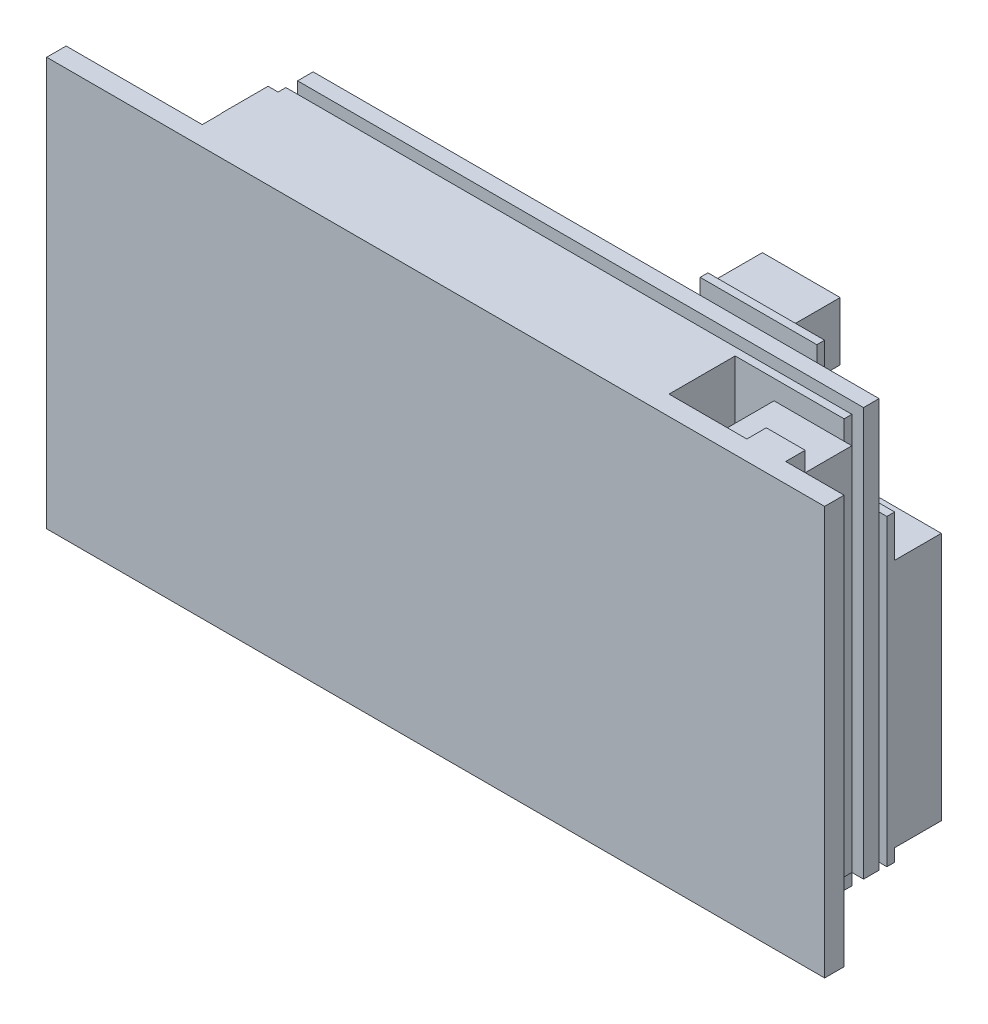
from build123d import *

# Parameters (mm, degrees)
SKETCH2_W            = 200
SKETCH2_H            = 105
BOSS_EXTRUDE1_DEPTH  = 5
SKETCH3_W            = 10
SKETCH3_H            = 105
BOSS_EXTRUDE2_DEPTH  = 5
SKETCH4_W            = 120
SKETCH4_H            = 10
BOSS_EXTRUDE3_DEPTH  = 5
SKETCH5_W            = 35
SKETCH5_H            = 50
BOSS_EXTRUDE4_DEPTH  = 5
SKETCH7_W            = 20
SKETCH7_H            = 95
SKETCH7_W_2          = 115.497788715
SKETCH7_H_2          = 20
SKETCH7_W_3          = 120.080954526
SKETCH7_W_4          = 14.207814016
SKETCH7_H_3          = 7
SKETCH7_H_4          = 10
BOSS_EXTRUDE5_DEPTH  = 12
SKETCH8_W            = 145.5
SKETCH8_H            = 105
BOSS_EXTRUDE6_DEPTH  = 2
BOSS_EXTRUDE7_DEPTH  = 4
SKETCH10_W           = 51
SKETCH10_H           = 49
BOSS_EXTRUDE8_DEPTH  = 14
SKETCH11_W           = 55
SKETCH11_H           = 78
BOSS_EXTRUDE9_DEPTH  = 2
SKETCH12_W           = 20
SKETCH12_H           = 64
SKETCH12_W_2         = 15
SKETCH12_H_2         = 20
BOSS_EXTRUDE10_DEPTH = 12
SKETCH13_W           = 30
SKETCH13_H           = 20
BOSS_EXTRUDE11_DEPTH = 2
SKETCH14_W           = 20
SKETCH14_H           = 15
BOSS_EXTRUDE12_DEPTH = 12


with BuildPart() as part:
    # Sketch2 → Boss-Extrude1 (new body)
    with BuildSketch(Plane.XY):
        with Locations((100, 52.5)):
            Rectangle(SKETCH2_W, SKETCH2_H)
    extrude(amount=BOSS_EXTRUDE1_DEPTH)

    # Sketch3 → Boss-Extrude2 (add)
    with BuildSketch(Plane(origin=(0, 0, 0), x_dir=(-1, 0, 0), z_dir=(0, 0, -1))):
        with Locations((-180, 52.5)):
            Rectangle(SKETCH3_W, SKETCH3_H)
    extrude(amount=BOSS_EXTRUDE2_DEPTH)

    # Sketch4 → Boss-Extrude3 (add)
    with BuildSketch(Plane.XY):
        with Locations((95, 5)):
            Rectangle(SKETCH4_W, SKETCH4_H)
        with Locations((95, 100)):
            Rectangle(SKETCH4_W, SKETCH4_H)
    extrude(amount=-BOSS_EXTRUDE3_DEPTH)

    # Sketch5 → Boss-Extrude4 (add)
    with BuildSketch(Plane.XY):
        with Locations((20.5, 55)):
            Rectangle(SKETCH5_W, SKETCH5_H)
    extrude(amount=-BOSS_EXTRUDE4_DEPTH)

    # Sketch7 → Boss-Extrude5 (add)
    with BuildSketch(Plane.XY.offset(-5)):
        with Locations((175, 52.5)):
            Rectangle(SKETCH7_W, SKETCH7_H)
        with Locations((97.251105642, 10)):
            Rectangle(SKETCH7_W_2, SKETCH7_H_2)
        with Locations((94.959522737, 95)):
            Rectangle(SKETCH7_W_3, SKETCH7_H_2)
        with Locations((39.043894704, 70.093234871)):
            Rectangle(SKETCH7_W_4, SKETCH7_H_3)
        with Locations((39.043894704, 46.844139488)):
            Rectangle(SKETCH7_W_4, SKETCH7_H_4)
    extrude(amount=-BOSS_EXTRUDE5_DEPTH)

    # Sketch8 → Boss-Extrude6 (add)
    with BuildSketch(Plane.XY.offset(-17)):
        with Locations((110.25, 52.5)):
            Rectangle(SKETCH8_W, SKETCH8_H)
    extrude(amount=-BOSS_EXTRUDE6_DEPTH)



with BuildPart() as body_2:
    # Sketch9 → Boss-Extrude7 (new body)
    with BuildSketch(Plane.XY.offset(-22)):
        Polygon((37.5, 0), (183, 0), (183, 105), (37.5, 105), (37.5, 77), (107.5, 77), (107.5, 28), (37.5, 28), align=None)
    extrude(amount=-BOSS_EXTRUDE7_DEPTH)


with BuildPart() as part_1:
    add(part.part)

    add(body_2.part)  # Boss-Extrude8 merges body 2
    # Sketch10 → Boss-Extrude8 (add)
    with BuildSketch(Plane.XY.offset(-17)):
        with Locations((78, 52.5)):
            Rectangle(SKETCH10_W, SKETCH10_H)
    extrude(amount=-BOSS_EXTRUDE8_DEPTH)


with BuildPart() as body_2_2:
    # Sketch11 → Boss-Extrude9 (new body)
    with BuildSketch(Plane.XY.offset(-28)):
        with Locations((155.5, 38.761527983)):
            Rectangle(SKETCH11_W, SKETCH11_H)
    extrude(amount=-BOSS_EXTRUDE9_DEPTH)

    # Sketch12 → Boss-Extrude10 (add)
    with BuildSketch(Plane.XY.offset(-30)):
        with Locations((173, 35)):
            Rectangle(SKETCH12_W, SKETCH12_H)
        with Locations((150.5, 10)):
            Rectangle(SKETCH12_W_2, SKETCH12_H_2)
    extrude(amount=-BOSS_EXTRUDE10_DEPTH)


with BuildPart() as body_3:
    # Sketch13 → Boss-Extrude11 (new body)
    with BuildSketch(Plane.XY.offset(-32)):
        with Locations((148, 95)):
            Rectangle(SKETCH13_W, SKETCH13_H)
    extrude(amount=BOSS_EXTRUDE11_DEPTH)


with BuildPart() as body_4:
    # Sketch14 → Boss-Extrude12 (new body)
    with BuildSketch(Plane.XY.offset(-34)):
        with Locations((143, 95)):
            Rectangle(SKETCH14_W, SKETCH14_H)
    extrude(amount=-BOSS_EXTRUDE12_DEPTH)


solid = Compound([part_1.part, body_2_2.part, body_3.part, body_4.part])
